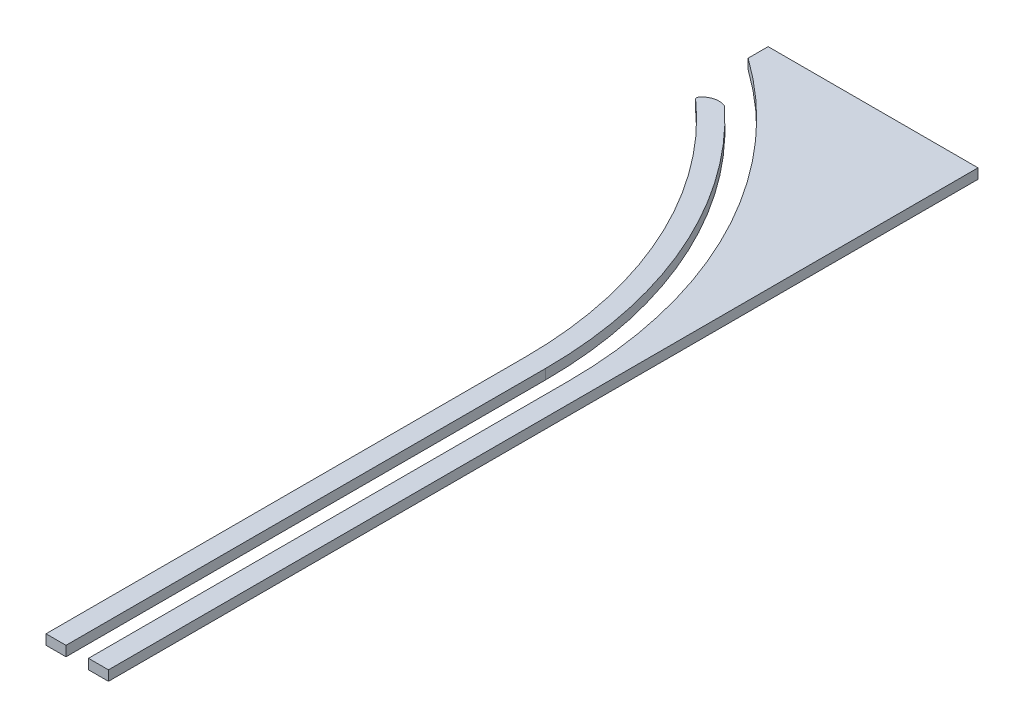
from build123d import *

# Parameters (mm, degrees)
BOSS_EXTRUDE1_DEPTH   = 12.7
BOSS_EXTRUDE1_2_DEPTH = 12.7


with BuildPart() as part:
    # Sketch2 → Boss-Extrude1 (new body)
    with BuildSketch(Plane(origin=(0, 0, 0), x_dir=(1, 0, 0), z_dir=(0, 1, 0))):
        with BuildLine():
            Line((230.1875, 0), (230.1875, 609.6))
            ThreePointArc((230.1875, 609.6), (166.336893569, 873.717256157), (-11.1125, 1079.5))
            Line((-11.1125, 1079.5), (-11.1125, 1104.9))
            Line((-11.1125, 1104.9), (255.5875, 1104.9))
            Line((255.5875, 1104.9), (255.5875, 0))
            Line((255.5875, 0), (230.1875, 0))
        make_face()
    extrude(amount=BOSS_EXTRUDE1_DEPTH)


with BuildPart() as body_2:
    # Sketch2 → Boss-Extrude1 2 (new body)
    with BuildSketch(Plane(origin=(0, 0, 0), x_dir=(1, 0, 0), z_dir=(0, 1, 0))):
        with BuildLine():
            Line((176.2125, 0), (201.6125, 0))
            Line((201.6125, 0), (201.6125, 609.6))
            ThreePointArc((201.6125, 609.6), (155.969091122, 828.891484249), (26.619962964, 1011.759958522))
            ThreePointArc((26.619962964, 1011.759958522), (12.010979758, 1013.05521959), (0.017727249, 1004.613538133))
            ThreePointArc((0.017727249, 1004.613538133), (-0.417598286, 1002.865028377), (0.416364306, 1001.267749102))
            ThreePointArc((0.416364306, 1001.267749102), (130.248330899, 824.255483864), (176.2125, 609.6))
            Line((176.2125, 609.6), (176.2125, 0))
        make_face()
    extrude(amount=BOSS_EXTRUDE1_2_DEPTH)


solid = Compound([part.part, body_2.part])
